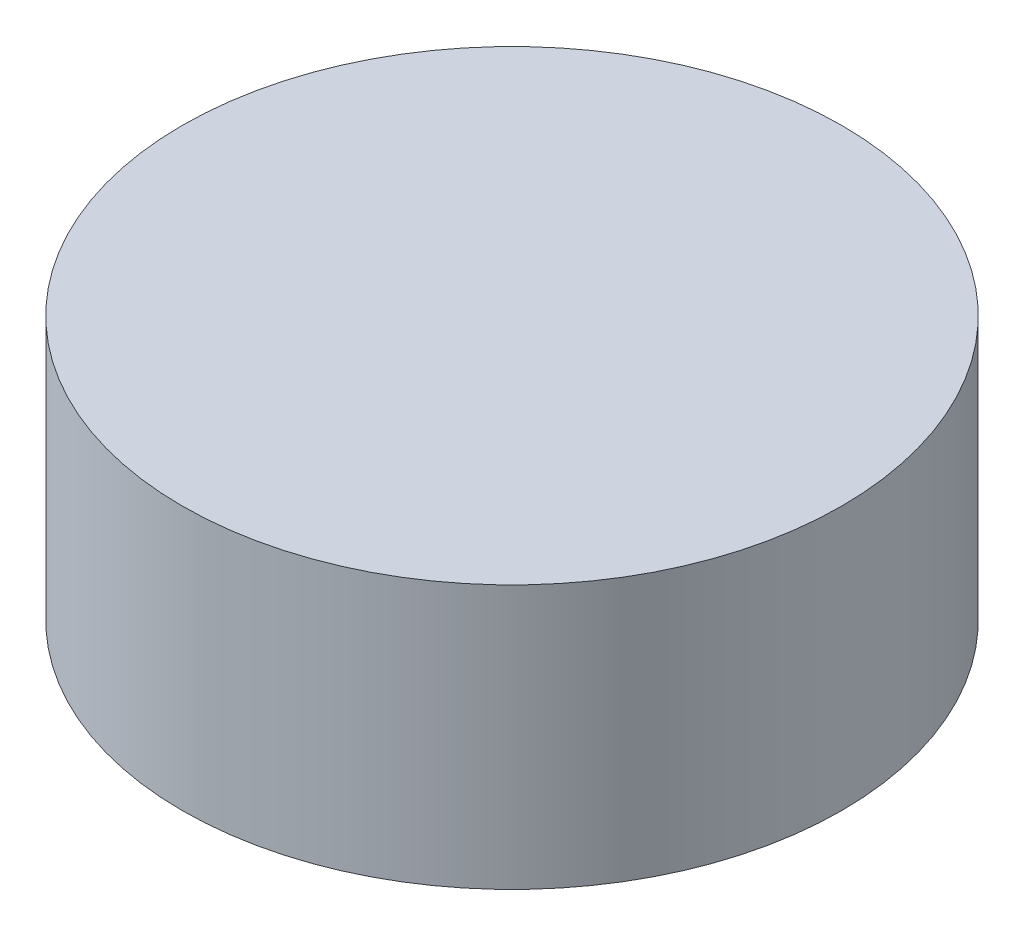
from build123d import *

# Parameters (mm, degrees)
SZKIC1_W = 50
SZKIC1_H = 40


with BuildPart() as part:
    # Szkic1 → Obrót1 (revolve)
    with BuildSketch(Plane.XY):
        with Locations((-25, -23.287770383)):
            Rectangle(SZKIC1_W, SZKIC1_H)
    revolve(axis=Axis((0, -3.287770383, 0), (0, -1, 0)))


solid = part.part
